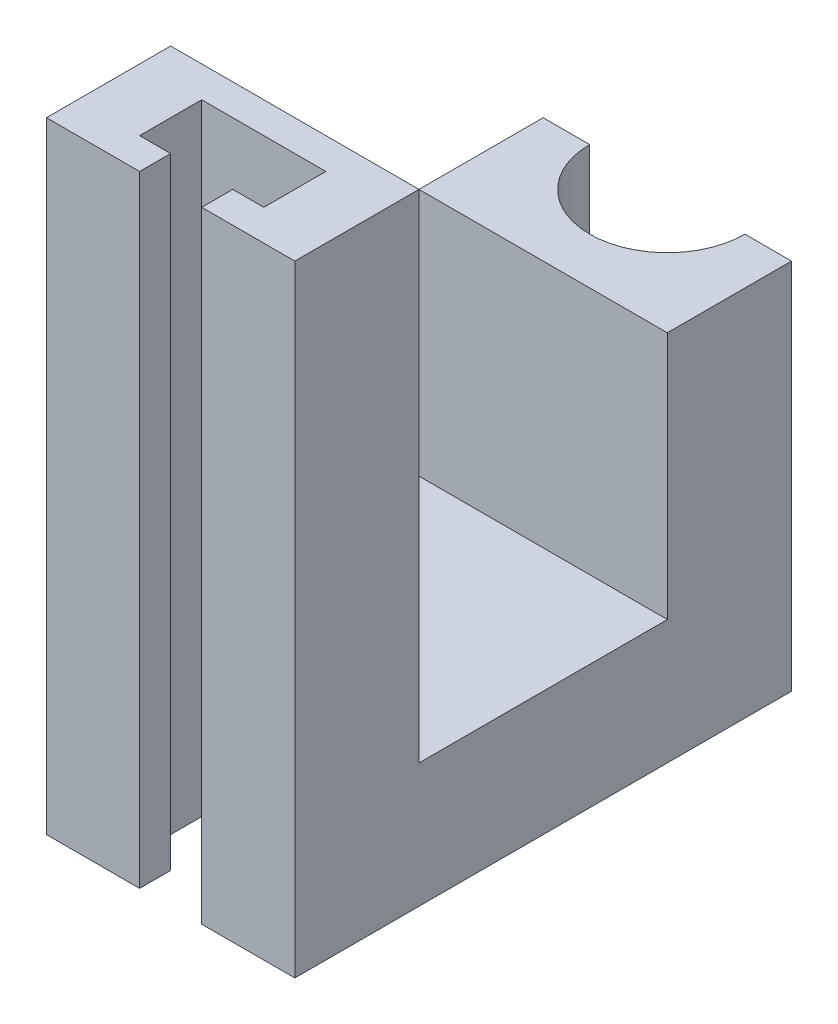
from build123d import *

# Parameters (mm, degrees)
BOSS_EXTRUDE1_DEPTH = 100
CUT_EXTRUDE1_REACH  = 136.592
SKETCH2_W           = 40
SKETCH2_H           = 80
CUT_EXTRUDE2_REACH  = 136.592
SKETCH3_W           = 20
SKETCH3_H           = 40


with BuildPart() as part:
    # Sketch1 → Boss-Extrude1 (new body)
    with BuildSketch(Plane(origin=(0, 0, 0), x_dir=(1, 0, 0), z_dir=(0, 1, 0))):
        with BuildLine():
            Line((-3.340812697, 5.715191165), (-3.340812697, 15.715191165))
            Line((-3.340812697, 15.715191165), (16.659187303, 15.715191165))
            Line((16.659187303, 15.715191165), (16.659187303, 5.715191165))
            Line((16.659187303, 5.715191165), (11.659187303, 5.715191165))
            Line((11.659187303, 5.715191165), (11.659187303, 0.715191165))
            Line((11.659187303, 0.715191165), (26.659187303, 0.715191165))
            Line((26.659187303, 0.715191165), (26.659187303, 80.715191165))
            Line((26.659187303, 80.715191165), (19.159187303, 80.715191165))
            ThreePointArc((19.159187303, 80.715191165), (6.659187303, 68.215191165), (-5.840812697, 80.715191165))
            Line((-5.840812697, 80.715191165), (-13.340812697, 80.715191165))
            Line((-13.340812697, 80.715191165), (-13.340812697, 0.715191165))
            Line((-13.340812697, 0.715191165), (1.659187303, 0.715191165))
            Line((1.659187303, 0.715191165), (1.659187303, 5.715191165))
            Line((1.659187303, 5.715191165), (-3.340812697, 5.715191165))
        make_face()
    extrude(amount=BOSS_EXTRUDE1_DEPTH)

    # Sketch2 → Cut-Extrude1 (cut, up to next)
    with BuildSketch(Plane.ZY.offset(13.340812697), mode=Mode.PRIVATE) as cut_extrude1_sk1:
        with Locations((-40.715191165, 60)):
            Rectangle(SKETCH2_W, SKETCH2_H)
    cut_extrude1_tool1 = extrude(cut_extrude1_sk1.sketch, amount=-CUT_EXTRUDE1_REACH, mode=Mode.PRIVATE) & part.part
    add(cut_extrude1_tool1.solids().sort_by_distance((-13.340813, 60, -40.715191))[0], mode=Mode.SUBTRACT)

    # Sketch3 → Cut-Extrude2 (cut, up to next)
    with BuildSketch(Plane.ZY.offset(13.340812697), mode=Mode.PRIVATE) as cut_extrude2_sk1:
        with Locations((-70.715191165, 80)):
            Rectangle(SKETCH3_W, SKETCH3_H)
    cut_extrude2_tool1 = extrude(cut_extrude2_sk1.sketch, amount=-CUT_EXTRUDE2_REACH, mode=Mode.PRIVATE) & part.part
    add(cut_extrude2_tool1.solids().sort_by_distance((-13.340813, 80, -70.715191))[0], mode=Mode.SUBTRACT)


solid = part.part
